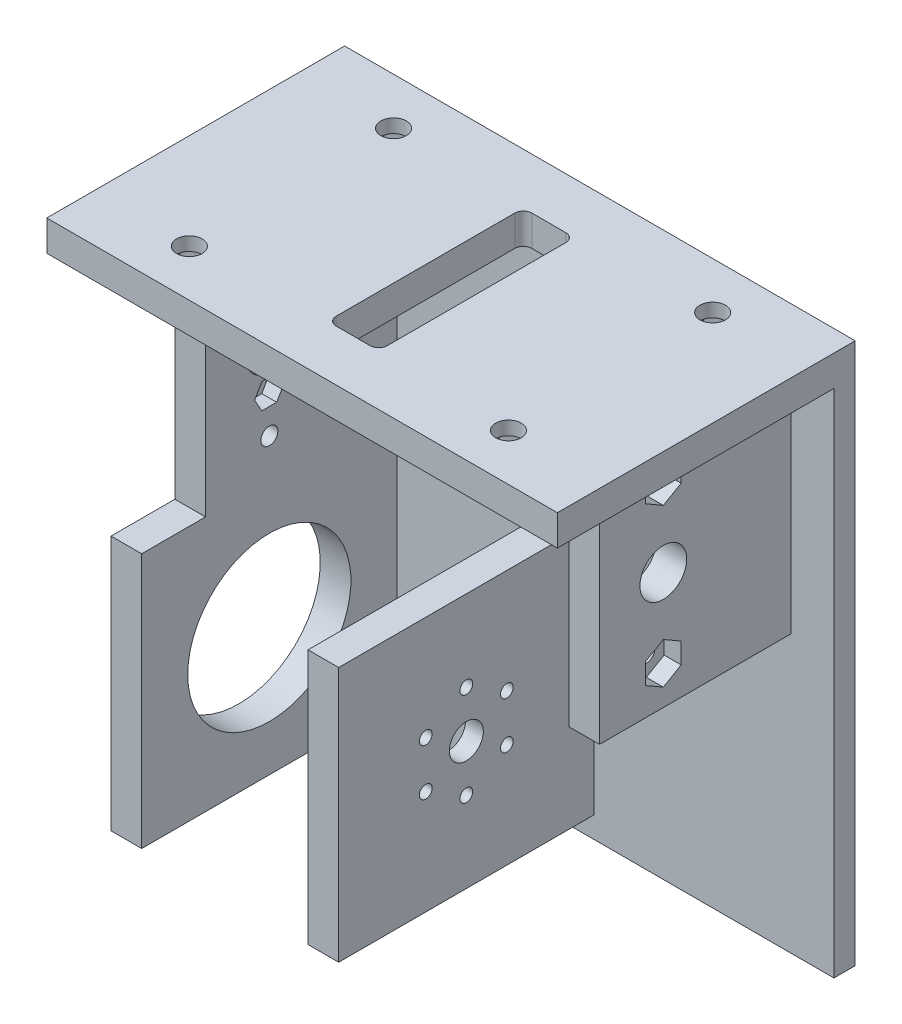
from build123d import *

# Parameters (mm, degrees)
SKETCH1_W                = 120
SKETCH1_H                = 70
SKETCH1_R                = 3
SKETCH1_W_2              = 12
SKETCH1_H_2              = 46
BOSS_EXTRUDE1_DEPTH      = 7.2
FILLET1_R                = 2
SKETCH2_W                = 120
SKETCH2_H                = 5
BOSS_EXTRUDE2_DEPTH      = 120
SKETCH9_W                = 7.2
SKETCH9_H                = 55
BOSS_EXTRUDE3_DEPTH      = 45
CUT_EXTRUDE5_DEPTH       = 167.442212194
CUT_EXTRUDE5_DEPTH_BACK  = 167.442212194
SKETCH10_R               = 5.5
SKETCH10_R_2             = 2
CUT_EXTRUDE4_DEPTH       = 4
CUT_EXTRUDE6_DEPTH       = 4
CUT_EXTRUDE7_DEPTH       = 4
SKETCH15_R               = 1.5
CUT_EXTRUDE8_DEPTH       = 7.2
CUT_EXTRUDE9_DEPTH       = 3.5
SKETCH17_W               = 7.2
SKETCH17_H               = 60
BOSS_EXTRUDE4_DEPTH      = 60
CUT_EXTRUDE10_DEPTH      = 141.249634581
CUT_EXTRUDE10_DEPTH_BACK = 141.249634581
SKETCH18_R               = 4
SKETCH19_R               = 1.5
CUT_EXTRUDE11_DEPTH      = 7.2
SKETCH20_R               = 8.5
CUT_EXTRUDE12_DEPTH      = 3
SKETCH21_R               = 19.175
CUT_EXTRUDE13_DEPTH      = 7.2


with BuildPart() as part:
    # Sketch1 → Boss-Extrude1 (new body)
    with BuildSketch(Plane(origin=(0, 0, 0), x_dir=(1, 0, 0), z_dir=(0, 1, 0))):
        Rectangle(SKETCH1_W, SKETCH1_H)
        with Locations(Location((-37.5, 24, 0), (0, 0, 270))):
            Circle(SKETCH1_R, mode=Mode.SUBTRACT)
        with Locations(Location((-37.5, -24, 0), (0, 0, 90))):
            Circle(SKETCH1_R, mode=Mode.SUBTRACT)
        with Locations(Location((37.5, 24, 0), (0, 0, 90))):
            Circle(SKETCH1_R, mode=Mode.SUBTRACT)
        with Locations(Location((37.5, -24, 0), (0, 0, 270))):
            Circle(SKETCH1_R, mode=Mode.SUBTRACT)
        Rectangle(SKETCH1_W_2, SKETCH1_H_2, mode=Mode.SUBTRACT)
    extrude(amount=BOSS_EXTRUDE1_DEPTH)

    # Fillet1
    fillet1_edges = [part.edges().sort_by_distance(p)[0] for p in [
        (-6, 3.6, -23),
        (-6, 3.6, 23),
        (6, 3.6, 23),
        (6, 3.6, -23),
    ]]
    fillet(fillet1_edges, radius=FILLET1_R)

    # Sketch2 → Boss-Extrude2 (add)
    with BuildSketch(Plane.XZ):
        with Locations((0, -32.5)):
            Rectangle(SKETCH2_W, SKETCH2_H)
    extrude(amount=BOSS_EXTRUDE2_DEPTH)

    # Sketch9 → Boss-Extrude3 (add)
    with BuildSketch(Plane.XY.offset(-30)):
        with Locations((-46.3, -27.5)):
            Rectangle(SKETCH9_W, SKETCH9_H)
        with Locations((46.3, -27.5)):
            Rectangle(SKETCH9_W, SKETCH9_H)
    extrude(amount=BOSS_EXTRUDE3_DEPTH)

    # Sketch10 → Cut-Extrude5 (cut, two sides: drawn at the far end of the back side and taken through both)
    with BuildSketch(Plane.ZY.offset(49.9).offset(-CUT_EXTRUDE5_DEPTH_BACK)):
        with Locations(Location((0, -27.5, 0), (0, 0, 270))):
            Circle(SKETCH10_R)
        with Locations(Location((0, -9, 0), (0, 0, 270))):
            Circle(SKETCH10_R_2)
        with Locations(Location((0, -46, 0), (0, 0, 270))):
            Circle(SKETCH10_R_2)
    extrude(amount=CUT_EXTRUDE5_DEPTH + CUT_EXTRUDE5_DEPTH_BACK, mode=Mode.SUBTRACT)

    # Sketch8 → Cut-Extrude4 (cut)
    with BuildSketch(Plane.XZ):
        Polygon((42.7, 27.0022214), (37.5, 30.0044428), (32.3, 27.0022214), (32.3, 20.9977786), (37.5, 17.9955572), (42.7, 20.9977786), align=None)
        Polygon((-32.3, 27.0022214), (-37.5, 30.0044428), (-42.7, 27.0022214), (-42.7, 20.9977786), (-37.5, 17.9955572), (-32.3, 20.9977786), align=None)
        Polygon((42.7, -20.9977786), (37.5, -17.9955572), (32.3, -20.9977786), (32.3, -27.0022214), (37.5, -30.0044428), (42.7, -27.0022214), align=None)
        Polygon((-32.3, -20.9977786), (-37.5, -17.9955572), (-42.7, -20.9977786), (-42.7, -27.0022214), (-37.5, -30.0044428), (-32.3, -27.0022214), align=None)
    extrude(amount=-CUT_EXTRUDE4_DEPTH, mode=Mode.SUBTRACT)

    # Sketch11 → Cut-Extrude6 (cut)
    with BuildSketch(Plane.ZY.offset(49.9)):
        Polygon((0, -13.849742261), (4.2, -11.424871131), (4.2, -6.575128869), (0, -4.150257739), (-4.2, -6.575128869), (-4.2, -11.424871131), align=None)
        Polygon((0, -50.849742261), (4.2, -48.424871131), (4.2, -43.575128869), (0, -41.150257739), (-4.2, -43.575128869), (-4.2, -48.424871131), align=None)
    extrude(amount=-CUT_EXTRUDE6_DEPTH, mode=Mode.SUBTRACT)

    # Sketch12 → Cut-Extrude7 (cut)
    with BuildSketch(Plane(origin=(49.9, 0, 0), x_dir=(0, 0, -1), z_dir=(1, 0, 0))):
        Polygon((0, -13.849742261), (4.2, -11.424871131), (4.2, -6.575128869), (0, -4.150257739), (-4.2, -6.575128869), (-4.2, -11.424871131), align=None)
        Polygon((0, -41.150257739), (-4.2, -43.575128869), (-4.2, -48.424871131), (0, -50.849742261), (4.2, -48.424871131), (4.2, -43.575128869), align=None)
    extrude(amount=-CUT_EXTRUDE7_DEPTH, mode=Mode.SUBTRACT)

    # Sketch15 → Cut-Extrude8 (cut)
    with BuildSketch(Plane.ZY.offset(49.9)):
        with Locations((0, -17.975)):
            Circle(SKETCH15_R)
        with Locations((0, -37.025)):
            Circle(SKETCH15_R)
    extrude(amount=-CUT_EXTRUDE8_DEPTH, mode=Mode.SUBTRACT)

    # Sketch16 → Cut-Extrude9 (cut)
    with BuildSketch(Plane(origin=(-42.7, 0, 0), x_dir=(0, 0, -1), z_dir=(1, 0, 0))):
        Polygon((1.732050808, -14.975), (-1.732050808, -14.975), (-3.464101615, -17.975), (-1.732050808, -20.975), (1.732050808, -20.975), (3.464101615, -17.975), align=None)
        Polygon((1.732050808, -34.025), (-1.732050808, -34.025), (-3.464101615, -37.025), (-1.732050808, -40.025), (1.732050808, -40.025), (3.464101615, -37.025), align=None)
    extrude(amount=-CUT_EXTRUDE9_DEPTH, mode=Mode.SUBTRACT)

    # Sketch17 → Boss-Extrude4 (add)
    with BuildSketch(Plane.XY.offset(-30)):
        with Locations((0, -85)):
            Rectangle(SKETCH17_W, SKETCH17_H)
        with Locations((-46.3, -85)):
            Rectangle(SKETCH17_W, SKETCH17_H)
    extrude(amount=BOSS_EXTRUDE4_DEPTH)

    # Sketch18 → Cut-Extrude10 (cut, two sides: drawn at the far end of the back side and taken through both)
    with BuildSketch(Plane(origin=(3.6, 0, 0), x_dir=(0, 0, -1), z_dir=(1, 0, 0)).offset(-CUT_EXTRUDE10_DEPTH_BACK)):
        with Locations(Location((0, -85, 0), (0, 0, 90))):
            Circle(SKETCH18_R)
    extrude(amount=CUT_EXTRUDE10_DEPTH + CUT_EXTRUDE10_DEPTH_BACK, mode=Mode.SUBTRACT)

    # Sketch19 → Cut-Extrude11 (cut)
    with BuildSketch(Plane(origin=(3.6, 0, 0), x_dir=(0, 0, -1), z_dir=(1, 0, 0))):
        with Locations(Location((0, -74, 0), (0, 0, 90))):
            Circle(SKETCH19_R)
        with Locations(Location((9.526279442, -79.5, 0), (0, 0, 90))):
            Circle(SKETCH19_R)
        with Locations(Location((9.526279442, -90.5, 0), (0, 0, 90))):
            Circle(SKETCH19_R)
        with Locations(Location((0, -96, 0), (0, 0, 90))):
            Circle(SKETCH19_R)
        with Locations(Location((-9.526279442, -90.5, 0), (0, 0, 90))):
            Circle(SKETCH19_R)
        with Locations(Location((-9.526279442, -79.5, 0), (0, 0, 90))):
            Circle(SKETCH19_R)
    extrude(amount=-CUT_EXTRUDE11_DEPTH, mode=Mode.SUBTRACT)

    # Sketch20 → Cut-Extrude12 (cut)
    with BuildSketch(Plane.ZY.offset(3.6)):
        with Locations(Location((0, -85, 0), (0, 0, 270))):
            Circle(SKETCH20_R)
    extrude(amount=-CUT_EXTRUDE12_DEPTH, mode=Mode.SUBTRACT)

    # Sketch21 → Cut-Extrude13 (cut)
    with BuildSketch(Plane.ZY.offset(49.9)):
        with Locations((0, -85)):
            Circle(SKETCH21_R)
    extrude(amount=-CUT_EXTRUDE13_DEPTH, mode=Mode.SUBTRACT)


solid = part.part
